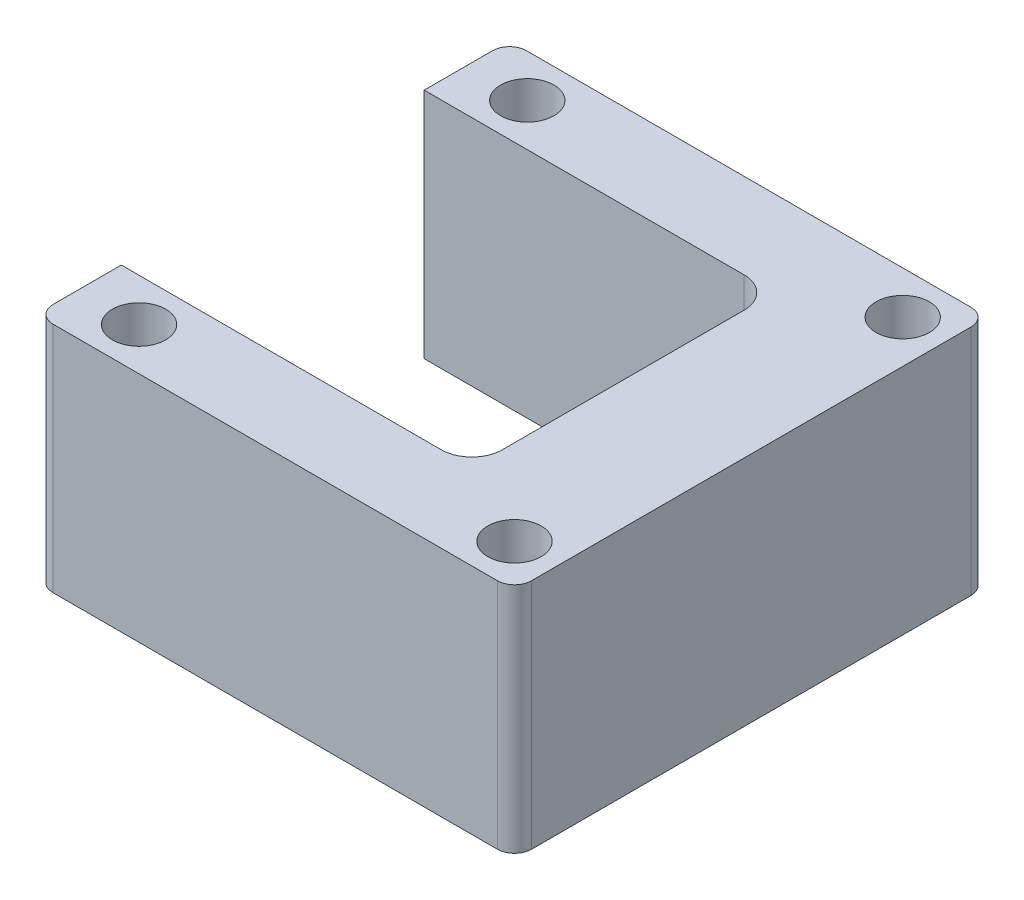
from build123d import *

# Parameters (mm, degrees)
BOSS_EXTRUDE2_DEPTH                            = 34.6202
CBORE_FOR_8_SOCKET_HEAD_CAP_SCREW2_D           = 4.4958
CBORE_FOR_8_SOCKET_HEAD_CAP_SCREW2_CBORE_D     = 7.9375
CBORE_FOR_8_SOCKET_HEAD_CAP_SCREW2_CBORE_DEPTH = 23.2156
FILLET2_R                                      = 4.55168
FILLET3_R                                      = 2.54


with BuildPart() as part:
    # Sketch1 → Boss-Extrude2 (new body)
    with BuildSketch(Plane(origin=(0, 0, 0), x_dir=(1, 0, 0), z_dir=(0, 1, 0))):
        Polygon((45.13707, 35.2425), (-26.08707, 35.2425), (-26.08707, 22.5425), (26.08707, 22.5425), (26.08707, -22.5425), (-26.08707, -22.5425), (-26.08707, -35.2425), (45.13707, -35.2425), align=None)
    extrude(amount=BOSS_EXTRUDE2_DEPTH)

    # CBORE for #8 Socket Head Cap Screw2 (through all)
    with Locations(Plane(origin=(0, 34.6202, 0), x_dir=(1, 0, 0), z_dir=(0, 1, 0))):
        with Locations((-72.97293, 28.8925), (38.78707, 28.8925), (38.78707, -28.8925), (-72.97293, -28.8925), (-17.09293, 28.8925), (-17.09293, -28.8925)):
            CounterBoreHole(CBORE_FOR_8_SOCKET_HEAD_CAP_SCREW2_D / 2, CBORE_FOR_8_SOCKET_HEAD_CAP_SCREW2_CBORE_D / 2, CBORE_FOR_8_SOCKET_HEAD_CAP_SCREW2_CBORE_DEPTH)

    # Fillet2
    fillet2_edges = [part.edges().sort_by_distance(p)[0] for p in [
        (26.08707, 17.3101, 22.5425),
        (26.08707, 17.3101, -22.5425),
    ]]
    fillet(fillet2_edges, radius=FILLET2_R)

    # Fillet3
    fillet3_edges = [part.edges().sort_by_distance(p)[0] for p in [
        (45.13707, 17.3101, -35.2425),
        (45.13707, 17.3101, 35.2425),
        (-26.08707, 17.3101, 35.2425),
        (-26.08707, 17.3101, -35.2425),
    ]]
    fillet(fillet3_edges, radius=FILLET3_R)


solid = part.part
